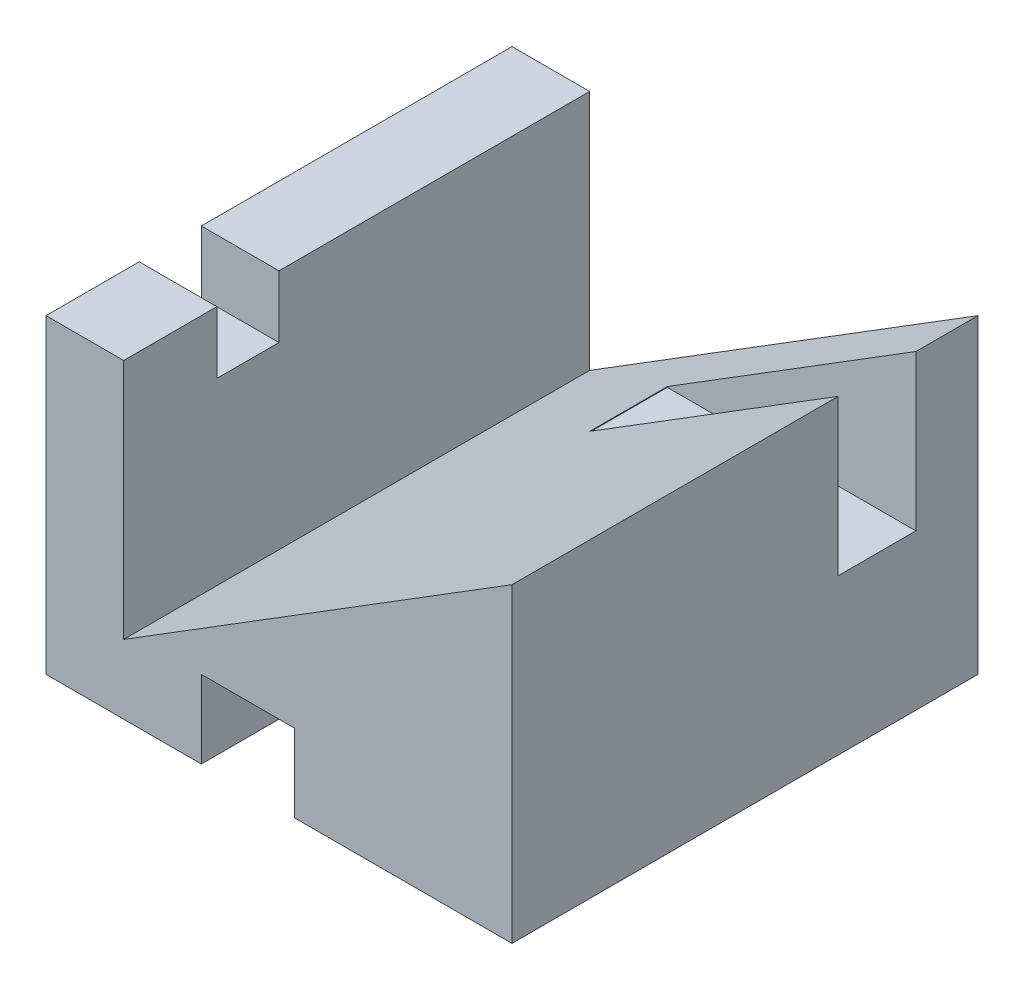
from build123d import *

# Parameters (mm, degrees)
SKETCH_1_W          = 30
SKETCH_1_H          = 20
EXTRUDE_1_DEPTH     = 30
SKETCH_2_W          = 6
SKETCH_2_H          = 5
CUT_EXTRUDE_1_DEPTH = 30
CUT_EXTRUDE_2_DEPTH = 30
SKETCH_4_W          = 5
SKETCH_4_H          = 4
CUT_EXTRUDE_3_DEPTH = 4
SKETCH_6_W          = 16
SKETCH_6_H          = 5
CUT_EXTRUDE_4_DEPTH = 10


with BuildPart() as part:
    # 草圖1 → 填料-伸長1 (new body)
    with BuildSketch(Plane.XY):
        Rectangle(SKETCH_1_W, SKETCH_1_H)
    extrude(amount=EXTRUDE_1_DEPTH)

    # 草圖2 → 除料-伸長1 (cut)
    with BuildSketch(Plane.XY.offset(30)):
        with Locations((-2, -7.5)):
            Rectangle(SKETCH_2_W, SKETCH_2_H)
    extrude(amount=-CUT_EXTRUDE_1_DEPTH, mode=Mode.SUBTRACT)

    # 草圖3 → 除料-伸長2 (cut)
    with BuildSketch(Plane.XY.offset(30)):
        Polygon((-10, 10), (-10, -5.551195207), (15, 10), align=None)
    extrude(amount=-CUT_EXTRUDE_2_DEPTH, mode=Mode.SUBTRACT)

    # 草圖4 → 除料-伸長3 (cut)
    with BuildSketch(Plane(origin=(0, 10, 0), x_dir=(1, 0, 0), z_dir=(0, 1, 0))):
        with Locations((-12.5, -22)):
            Rectangle(SKETCH_4_W, SKETCH_4_H)
    extrude(amount=-CUT_EXTRUDE_3_DEPTH, mode=Mode.SUBTRACT)

    # 草圖6 → 除料-伸長4 (cut)
    with BuildSketch(Plane(origin=(0, 10, 0), x_dir=(1, 0, 0), z_dir=(0, 1, 0))):
        with Locations((7, -6.5)):
            Rectangle(SKETCH_6_W, SKETCH_6_H)
    extrude(amount=-CUT_EXTRUDE_4_DEPTH, mode=Mode.SUBTRACT)


solid = part.part
